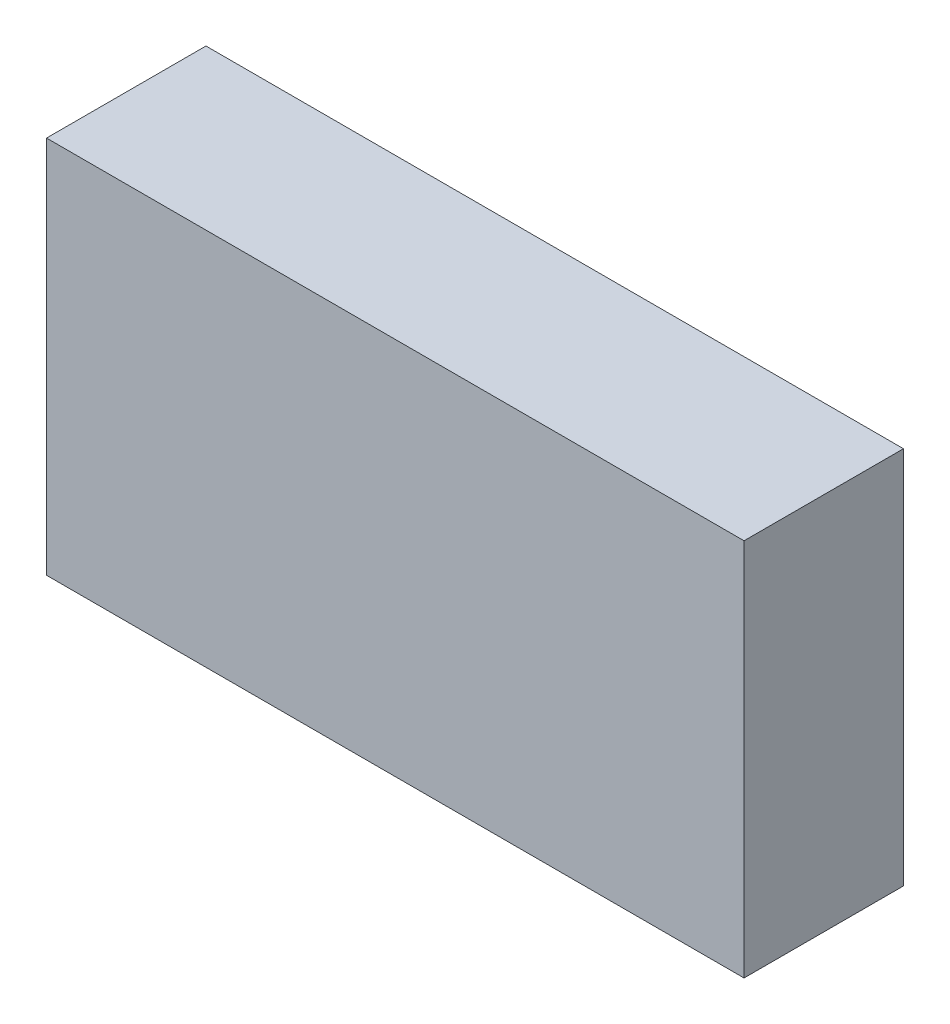
from build123d import *

# Parameters (mm, degrees)
SKETCH_1_W      = 1.75
SKETCH_1_H      = 0.95
EXTRUDE_1_DEPTH = 0.4


with BuildPart() as part:
    # 草图1 → 凸台-拉伸1 (new body)
    with BuildSketch(Plane.XY):
        Rectangle(SKETCH_1_W, SKETCH_1_H)
    extrude(amount=EXTRUDE_1_DEPTH)


solid = part.part
